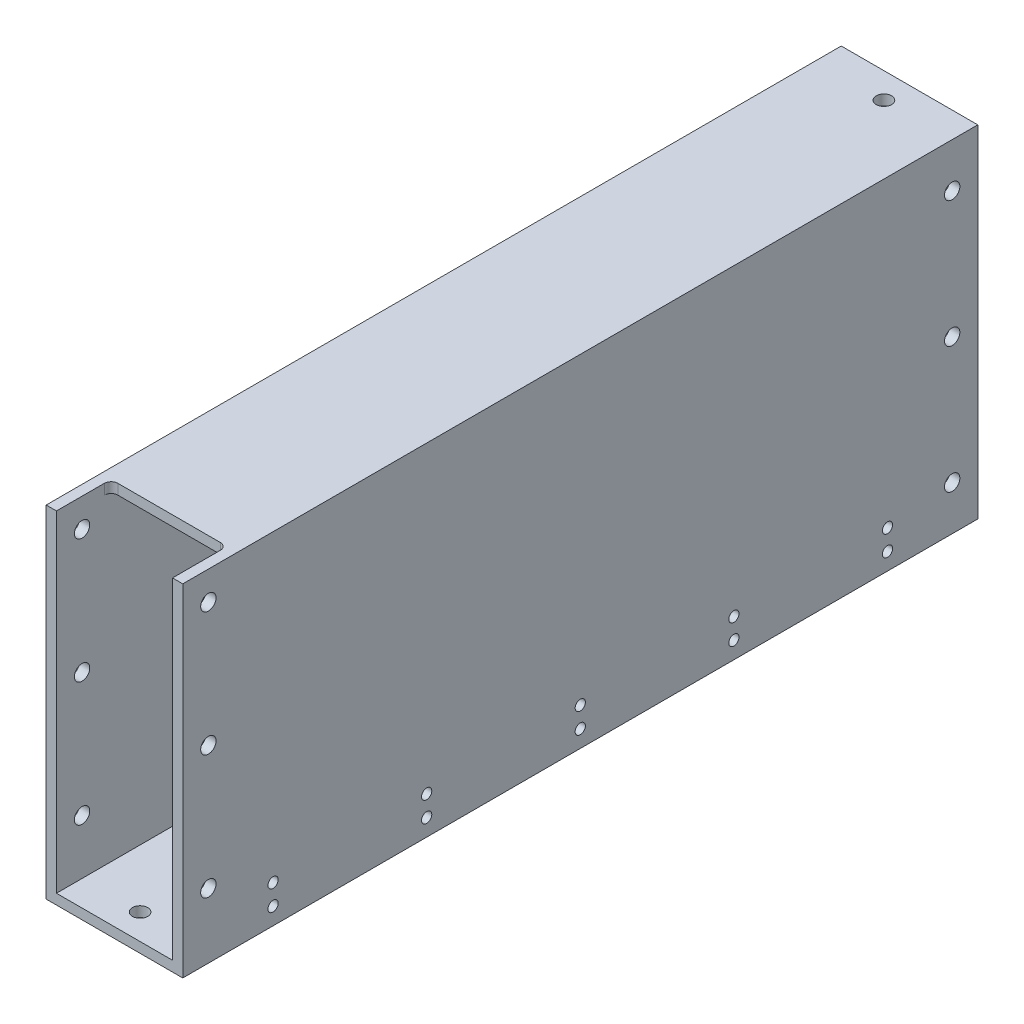
from build123d import *

# Parameters (mm, degrees)
SKETCH1_W                      = 40
SKETCH1_H                      = 100
SKETCH1_W_2                    = 34
SKETCH1_H_2                    = 94
BOSS_EXTRUDE1_DEPTH            = 232.9
CUT_EXTRUDE2_REACH             = 283.987
SKETCH8_W                      = 34
SKETCH8_H                      = 16
CUT_EXTRUDE2_DIRECTION_2_DEPTH = 282.986542232
M4_CLEARANCE_HOLE1_D           = 4.5
M4_CLEARANCE_HOLE1_ON_FACE_2_D = 4.5
M4_CLEARANCE_HOLE1_ON_FACE_3_D = 4.5
M4_CLEARANCE_HOLE1_ON_FACE_4_D = 4.5
FILLET1_R                      = 2
F_3_0_3_DIAMETER_HOLE1_D       = 3
F_3_0_3_DIAMETER_HOLE1_DEPTH   = 3


with BuildPart() as part:
    # Sketch1 → Boss-Extrude1 (new body)
    with BuildSketch(Plane.XY.offset(30)):
        Rectangle(SKETCH1_W, SKETCH1_H)
        Rectangle(SKETCH1_W_2, SKETCH1_H_2, mode=Mode.SUBTRACT)
    extrude(amount=BOSS_EXTRUDE1_DEPTH)

    # Sketch8 → Cut-Extrude2 (cut, up to next)
    with BuildSketch(Plane(origin=(0, 50, 0), x_dir=(1, 0, 0), z_dir=(0, 1, 0)), mode=Mode.PRIVATE) as cut_extrude2_sk1:
        with Locations((0, -254.9)):
            Rectangle(SKETCH8_W, SKETCH8_H)
    cut_extrude2_tool1 = extrude(cut_extrude2_sk1.sketch, amount=-CUT_EXTRUDE2_REACH, mode=Mode.PRIVATE) & part.part
    add(cut_extrude2_tool1.solids().sort_by_distance((0, 50, 254.9))[0], mode=Mode.SUBTRACT)

    # Sketch8 → Cut-Extrude2 direction 2 (cut)
    with BuildSketch(Plane(origin=(0, 50, 0), x_dir=(1, 0, 0), z_dir=(0, 1, 0))):
        with Locations((0, -254.9)):
            Rectangle(SKETCH8_W, SKETCH8_H)
    extrude(amount=CUT_EXTRUDE2_DIRECTION_2_DEPTH, mode=Mode.SUBTRACT)

    # M4 Clearance Hole1 (through all)
    with Locations(Plane(origin=(20, 37, 37.5), x_dir=(0, 0, 1), z_dir=(1, 0, 0))):
        with Locations((0, 0), (0, 37), (217.9, 68), (217.9, 31.7), (217.9, -4.6), (0, 74)):
            Hole(M4_CLEARANCE_HOLE1_D / 2)

    # M4 Clearance Hole1 on face 2 (through all)
    with Locations(Plane(origin=(0, 50, 37.5), x_dir=(0, 0, 1), z_dir=(0, 1, 0))):
        with Locations((0, 0)):
            Hole(M4_CLEARANCE_HOLE1_ON_FACE_2_D / 2)

    # M4 Clearance Hole1 on face 3 (through all)
    with Locations(Plane(origin=(-20, -37, 37.5), x_dir=(0, 0, -1), z_dir=(-1, 0, 0))):
        with Locations((0, 0), (0, -37), (0, -74), (-217.9, -6), (-217.9, -42.3), (-217.9, -78.6)):
            Hole(M4_CLEARANCE_HOLE1_ON_FACE_3_D / 2)

    # M4 Clearance Hole1 on face 4 (through all)
    with Locations(Plane(origin=(0, -50, 37.5), x_dir=(0, 0, -1), z_dir=(0, -1, 0))):
        with Locations((0, 0), (-217.9, 0)):
            Hole(M4_CLEARANCE_HOLE1_ON_FACE_4_D / 2)

    # Fillet1
    fillet1_edges = [part.edges().sort_by_distance(p)[0] for p in [
        (17, 48.5, 246.9),
        (-17, 48.5, 246.9),
    ]]
    fillet(fillet1_edges, radius=FILLET1_R)

    # Ø3.0 (3) Diameter Hole1
    with Locations(Plane(origin=(20, 0, 0), x_dir=(0, 0, -1), z_dir=(1, 0, 0))):
        with Locations((-56.45, -45), (-236.45, -39), (-236.45, -45), (-191.45, -39), (-146.45, -39), (-101.45, -39), (-56.45, -39), (-191.45, -45), (-146.45, -45), (-101.45, -45)):
            Hole(F_3_0_3_DIAMETER_HOLE1_D / 2, depth=F_3_0_3_DIAMETER_HOLE1_DEPTH)


solid = part.part
